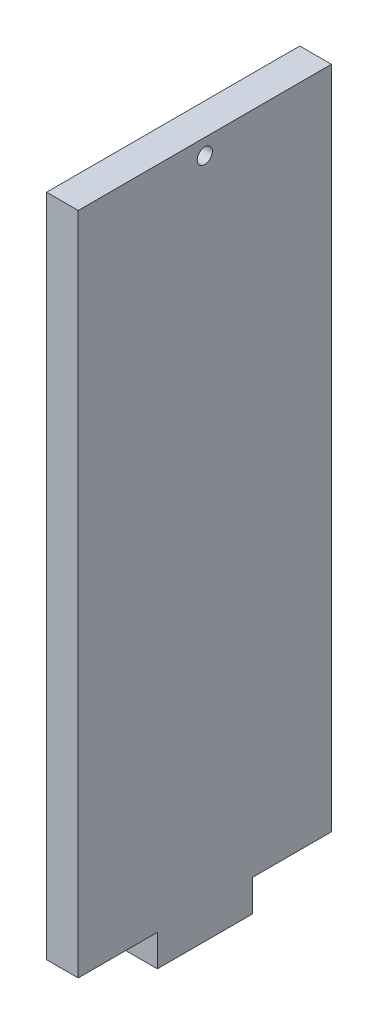
from build123d import *

# Parameters (mm, degrees)
SKETCH2_W           = 50.8
SKETCH2_H           = 127
BOSS_EXTRUDE1_DEPTH = 6.35
SKETCH3_W           = 19.05
SKETCH3_H           = 6.35
BOSS_EXTRUDE2_DEPTH = 6.35
SKETCH5_W           = 50.8
SKETCH5_H           = 6.35
BOSS_EXTRUDE3_DEPTH = 6.35
SKETCH6_R           = 1.524
CUT_EXTRUDE1_DEPTH  = 143.839717866


with BuildPart() as part:
    # Sketch2 → Boss-Extrude1 (new body)
    with BuildSketch(Plane(origin=(0, 0, 0), x_dir=(0, 0, -1), z_dir=(1, 0, 0))):
        with Locations((25.4, 63.5)):
            Rectangle(SKETCH2_W, SKETCH2_H)
    extrude(amount=BOSS_EXTRUDE1_DEPTH)

    # Sketch3 → Boss-Extrude2 (add)
    with BuildSketch(Plane(origin=(6.35, 0, 0), x_dir=(0, 0, -1), z_dir=(1, 0, 0))):
        with Locations((25.4, -3.175)):
            Rectangle(SKETCH3_W, SKETCH3_H)
    extrude(amount=-BOSS_EXTRUDE2_DEPTH)

    # Sketch5 → Boss-Extrude3 (add)
    with BuildSketch(Plane.ZY):
        with Locations((-25.4, 130.175)):
            Rectangle(SKETCH5_W, SKETCH5_H)
    extrude(amount=-BOSS_EXTRUDE3_DEPTH)

    # Sketch6 → Cut-Extrude1 (cut, through all)
    with BuildSketch(Plane(origin=(6.35, 0, 0), x_dir=(0, 0, -1), z_dir=(1, 0, 0))):
        with Locations((25.4, 130.175)):
            Circle(SKETCH6_R)
    extrude(amount=-CUT_EXTRUDE1_DEPTH, mode=Mode.SUBTRACT)


solid = part.part
